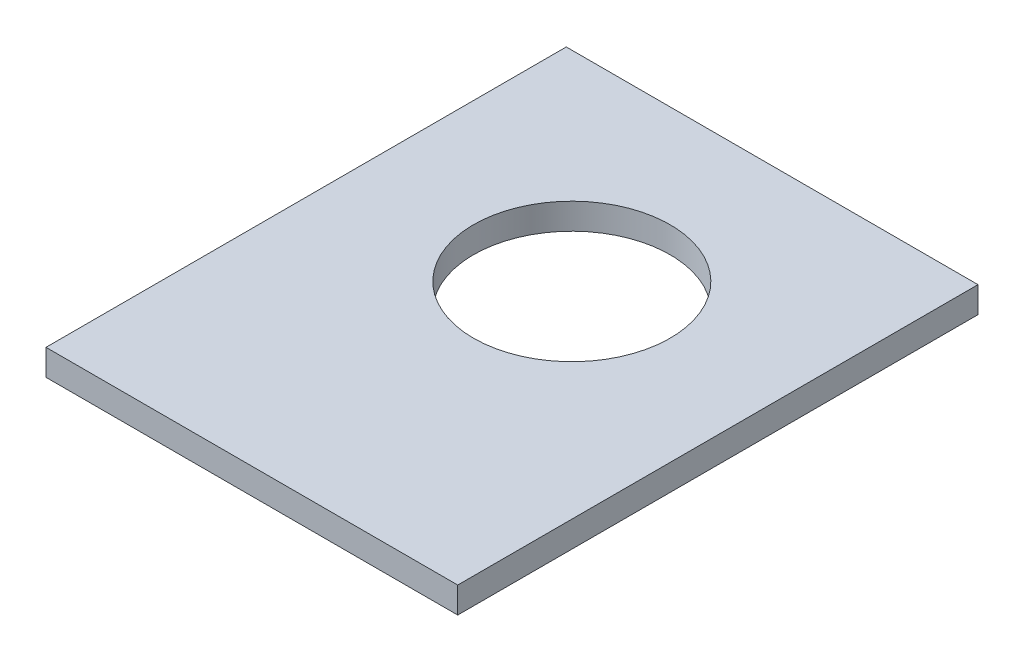
from build123d import *

# Parameters (mm, degrees)
SKETCH1_W           = 25.125819039
SKETCH1_H           = 31.75
SKETCH1_R           = 6
BOSS_EXTRUDE1_DEPTH = 1.5875


with BuildPart() as part:
    # Sketch1 → Boss-Extrude1 (new body)
    with BuildSketch(Plane(origin=(0, 0, 0), x_dir=(1, 0, 0), z_dir=(0, 1, 0))):
        with Locations((12.56290952, -15.875)):
            Rectangle(SKETCH1_W, SKETCH1_H)
        with Locations(Location((12.56290952, -12.224576831, 0), (0, 0, 270))):
            Circle(SKETCH1_R, mode=Mode.SUBTRACT)
    extrude(amount=BOSS_EXTRUDE1_DEPTH)


solid = part.part
